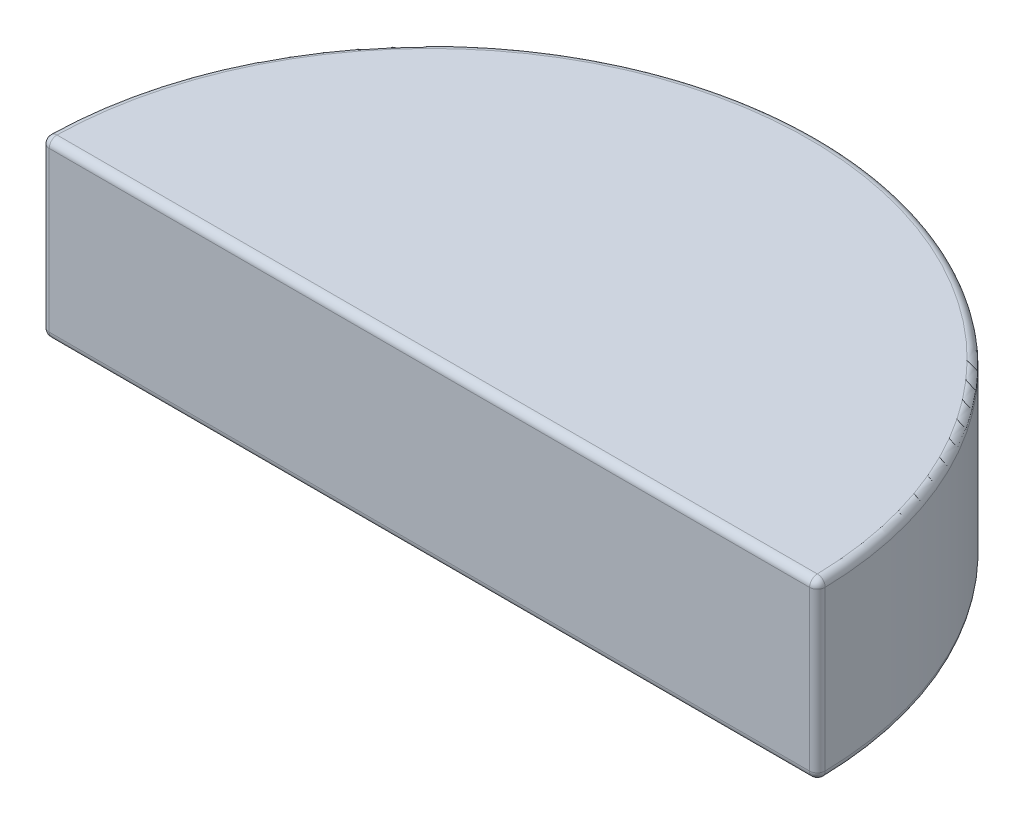
from build123d import *

# Parameters (mm, degrees)
BOSS_EXTRUDE1_DEPTH = 225
FILLET1_R           = 10


with BuildPart() as part:
    # Sketch1 → Boss-Extrude1 (new body)
    with BuildSketch(Plane(origin=(0, 0, 0), x_dir=(1, 0, 0), z_dir=(0, 1, 0))):
        with BuildLine():
            Line((0, 0), (1000, 0))
            ThreePointArc((1000, 0), (500, 500), (0, 0))
        make_face()
    extrude(amount=BOSS_EXTRUDE1_DEPTH)

    # Fillet1
    fillet1_edges = [part.edges().sort_by_distance(p)[0] for p in [
        (500, 0, 0),
        (500, 0, -500),
        (1000, 112.5, 0),
        (0, 112.5, 0),
        (500, 225, -500),
        (500, 225, 0),
    ]]
    fillet(fillet1_edges, radius=FILLET1_R)


solid = part.part
